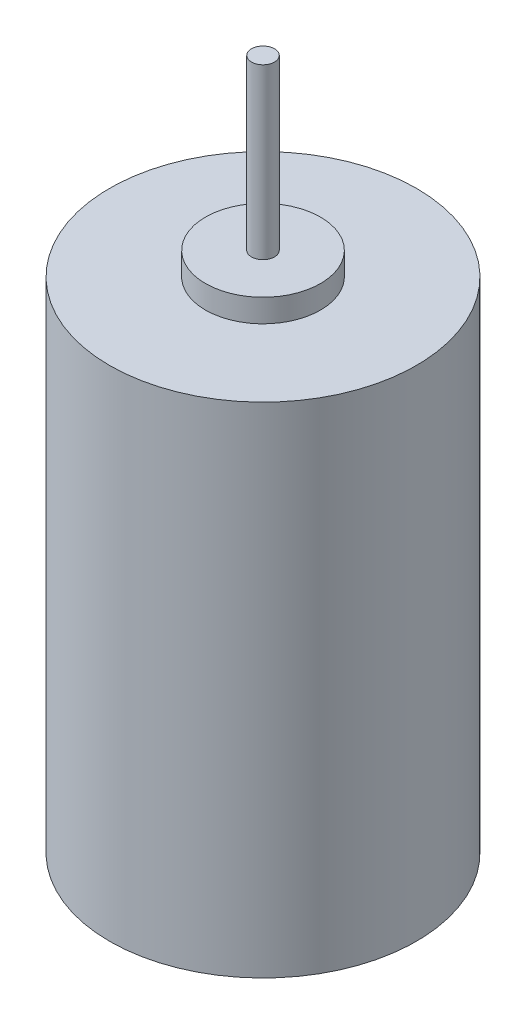
from build123d import *

# Parameters (mm, degrees)
SKETCH1_R                = 20
BOSS_EXTRUDE1_DEPTH      = 65
BOSS_EXTRUDE2_DEPTH      = 3
BOSS_EXTRUDE2_DEPTH_BACK = 68
SKETCH2_R                = 7.5
BOSS_EXTRUDE3_DEPTH      = 90
BOSS_EXTRUDE3_DEPTH_BACK = 10
SKETCH3_R                = 1.5


with BuildPart() as part:
    # Sketch1 → Boss-Extrude1 (new body)
    with BuildSketch(Plane(origin=(0, 0, 0), x_dir=(1, 0, 0), z_dir=(0, 1, 0))):
        with Locations(Location((0, 0, 0), (0, 0, 270))):
            Circle(SKETCH1_R)
    extrude(amount=BOSS_EXTRUDE1_DEPTH)

    # Sketch2 → Boss-Extrude2 (add, two sides: drawn at the far end of the back side and taken through both)
    with BuildSketch(Plane(origin=(0, 65, 0), x_dir=(1, 0, 0), z_dir=(0, 1, 0)).offset(-BOSS_EXTRUDE2_DEPTH_BACK)):
        with Locations(Location((0, 0, 0), (0, 0, 270))):
            Circle(SKETCH2_R)
    extrude(amount=BOSS_EXTRUDE2_DEPTH + BOSS_EXTRUDE2_DEPTH_BACK)

    # Sketch3 → Boss-Extrude3 (add, two sides: drawn at the far end of the back side and taken through both)
    with BuildSketch(Plane(origin=(0, 0, 0), x_dir=(1, 0, 0), z_dir=(0, 1, 0)).offset(-BOSS_EXTRUDE3_DEPTH_BACK)):
        with Locations(Location((0, 0, 0), (0, 0, 270))):
            Circle(SKETCH3_R)
    extrude(amount=BOSS_EXTRUDE3_DEPTH + BOSS_EXTRUDE3_DEPTH_BACK)


solid = part.part
